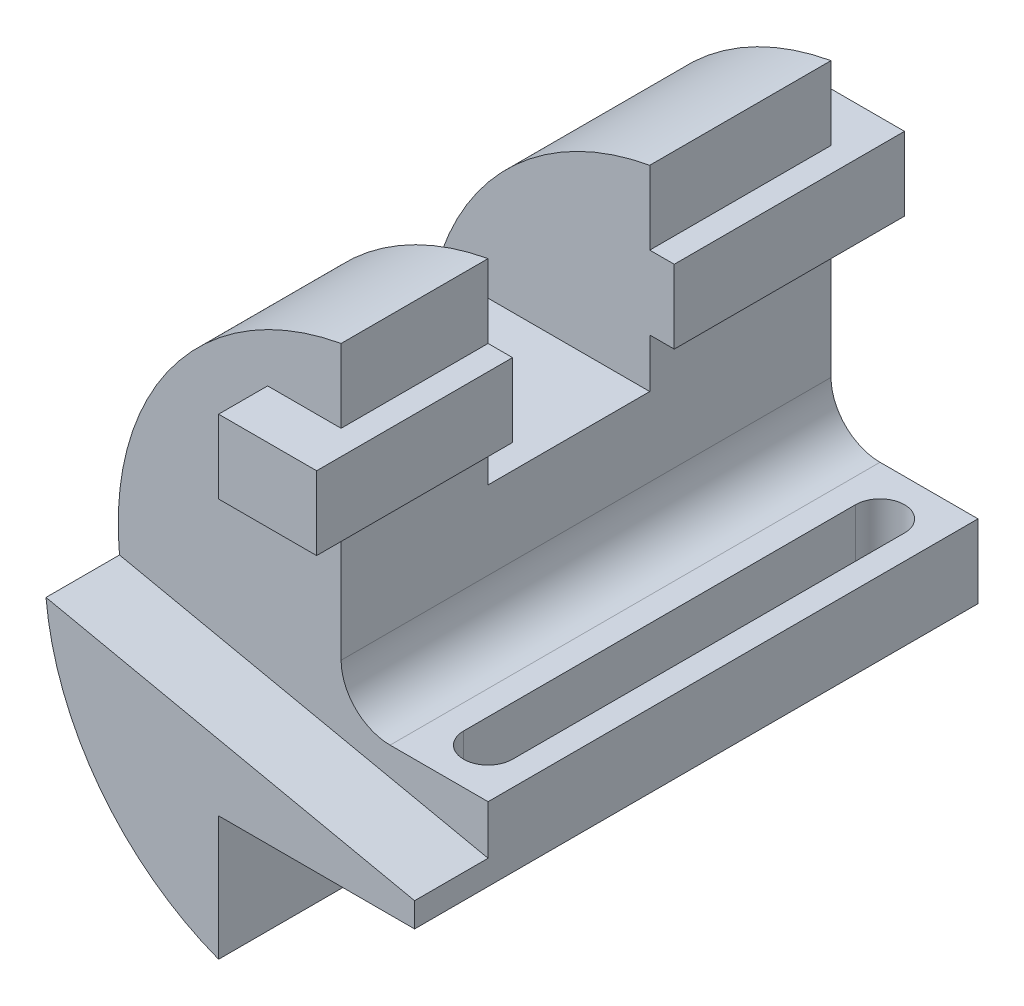
from build123d import *

# Parameters (mm, degrees)
BOSS_EXTRUDE1_DEPTH     = 100
CUT_EXTRUDE1_REACH      = 124.68
CUT_EXTRUDE1_END_RADIUS = 55.5
SKETCH4_W               = 33
SKETCH4_H               = 40
SKETCH5_W               = 40
SKETCH5_H               = 15
BOSS_EXTRUDE2_DEPTH     = 15
SKETCH6_W               = 40
SKETCH6_H               = 15
CUT_EXTRUDE2_DEPTH      = 10
SKETCH7_W               = 47
SKETCH7_H               = 15
BOSS_EXTRUDE3_DEPTH     = 5
SKETCH8_W               = 47
SKETCH8_H               = 15
BOSS_EXTRUDE4_DEPTH     = 20
CUT_EXTRUDE3_DEPTH      = 140.772135993
BOSS_EXTRUDE5_DEPTH     = 15


with BuildPart() as part:
    # Sketch1 → Boss-Extrude1 (new body)
    with BuildSketch(Plane.XY):
        with BuildLine():
            Line((-10, 54.591666031), (-10, -1.408333969))
            ThreePointArc((-10, -1.408333969), (-7.071067812, -8.479401781), (0, -11.408333969))
            Line((0, -11.408333969), (20, -11.408333969))
            Line((20, -11.408333969), (20, -26.408333969))
            Line((20, -26.408333969), (-20, -26.408333969))
            Line((-20, -26.408333969), (-20, -51.771130952))
            ThreePointArc((-20, -51.771130952), (-55.256322222, 5.195079839), (-10, 54.591666031))
        make_face()
    extrude(amount=BOSS_EXTRUDE1_DEPTH)

    # Cut-Extrude1: up to this cylinder (the profile starts inside it)
    cut_extrude1_end = Plane(origin=(0, 0, 53.5), z_dir=(0, 0, -1)) * Cylinder(CUT_EXTRUDE1_END_RADIUS, 361.36, mode=Mode.PRIVATE)
    # Sketch4 → Cut-Extrude1 (cut, up to the surface)
    with BuildSketch(Plane(origin=(-10, 0, 0), x_dir=(0, 0, -1), z_dir=(1, 0, 0)), mode=Mode.PRIVATE) as cut_extrude1_sk1:
        with Locations((-53.5, 34.591666031)):
            Rectangle(SKETCH4_W, SKETCH4_H)
    cut_extrude1_tool1 = extrude(cut_extrude1_sk1.sketch, amount=-CUT_EXTRUDE1_REACH, mode=Mode.PRIVATE) & cut_extrude1_end
    add(cut_extrude1_tool1.solids().sort_by_distance((-10, 34.591666, 53.5))[0], mode=Mode.SUBTRACT)

    # Sketch5 → Boss-Extrude2 (add, symmetric)
    with BuildSketch(Plane(origin=(-10, 0, 0), x_dir=(0, 0, -1), z_dir=(1, 0, 0))):
        with Locations((-90, 32.091666031)):
            Rectangle(SKETCH5_W, SKETCH5_H)
    extrude(amount=BOSS_EXTRUDE2_DEPTH, both=True)

    # Sketch6 → Cut-Extrude2 (cut)
    with BuildSketch(Plane(origin=(5, 0, 0), x_dir=(0, 0, -1), z_dir=(1, 0, 0))):
        with Locations((-90, 32.091666031)):
            Rectangle(SKETCH6_W, SKETCH6_H)
    extrude(amount=-CUT_EXTRUDE2_DEPTH, mode=Mode.SUBTRACT)

    # Sketch7 → Boss-Extrude3 (add, symmetric)
    with BuildSketch(Plane(origin=(-10, 0, 0), x_dir=(0, 0, -1), z_dir=(1, 0, 0))):
        with Locations((-13.5, 32.091666031)):
            Rectangle(SKETCH7_W, SKETCH7_H)
    extrude(amount=BOSS_EXTRUDE3_DEPTH, both=True)

    # Sketch8 → Boss-Extrude4 (add)
    with BuildSketch(Plane(origin=(-5, 0, 0), x_dir=(0, 0, -1), z_dir=(1, 0, 0))):
        with Locations((-13.5, 32.091666031)):
            Rectangle(SKETCH8_W, SKETCH8_H)
    extrude(amount=-BOSS_EXTRUDE4_DEPTH)

    # Sketch9 → Cut-Extrude3 (cut, through all)
    with BuildSketch(Plane(origin=(0, -11.408333969, 0), x_dir=(1, 0, 0), z_dir=(0, 1, 0))):
        with BuildLine():
            Line((15, -10), (15, -90))
            ThreePointArc((15, -90), (10, -95), (5, -90))
            Line((5, -90), (5, -10))
            ThreePointArc((5, -10), (10, -5), (15, -10))
        make_face()
    extrude(amount=-CUT_EXTRUDE3_DEPTH, mode=Mode.SUBTRACT)

    # Sketch10 → Boss-Extrude5 (add)
    with BuildSketch(Plane.XY.offset(100)):
        with BuildLine():
            Line((20, -26.408333969), (20, -21.408333969))
            Line((20, -21.408333969), (-55.235044142, -5.416631669))
            ThreePointArc((-55.235044142, -5.416631669), (-44.254717417, -33.638955135), (-20, -51.771130952))
            Line((-20, -51.771130952), (-20, -26.408333969))
            Line((-20, -26.408333969), (20, -26.408333969))
        make_face()
    extrude(amount=BOSS_EXTRUDE5_DEPTH)


solid = part.part
